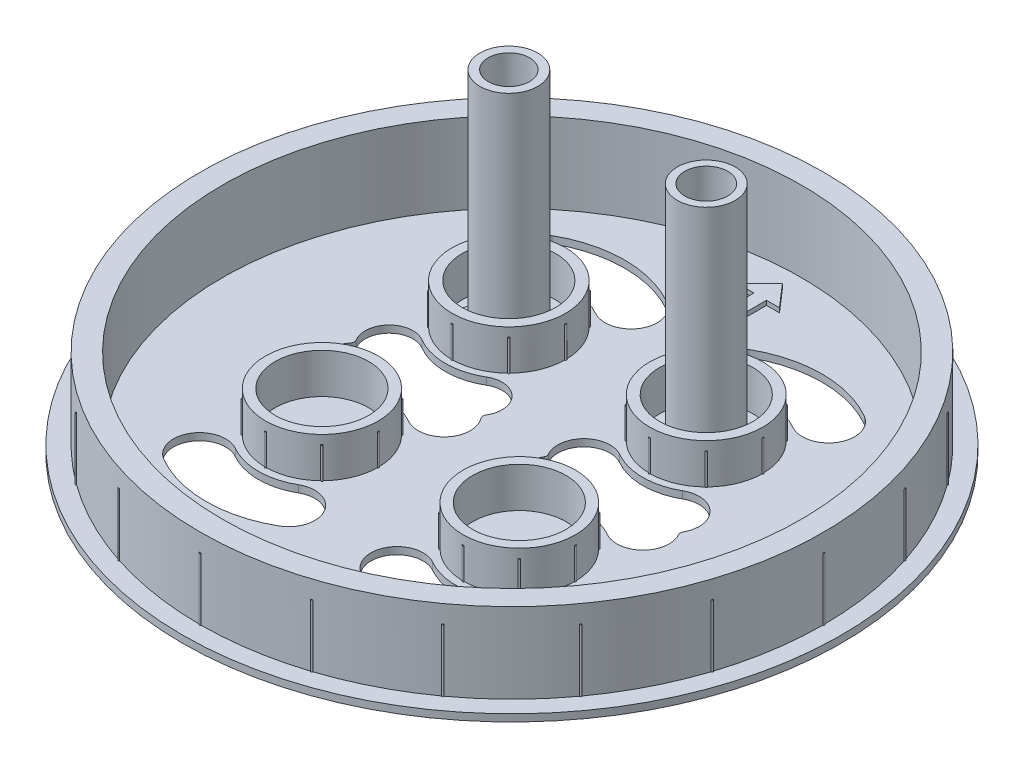
from build123d import *

# Parameters (mm, degrees)
SKETCH1_R           = 74
BOSS_EXTRUDE1_DEPTH = 1.6
SKETCH2_R           = 70
BOSS_EXTRUDE2_DEPTH = 18
SKETCH3_R           = 65
CUT_EXTRUDE1_DEPTH  = 18
SKETCH4_R           = 0.2
BOSS_EXTRUDE3_DEPTH = 14
SKETCH5_R           = 12.75
SKETCH5_R_2         = 12.7
SKETCH5_R_3         = 12.65
SKETCH5_R_4         = 12.6
BOSS_EXTRUDE4_DEPTH = 9
SKETCH6_R           = 10.5
CUT_EXTRUDE2_DEPTH  = 9
SKETCH7_R           = 0.2
BOSS_EXTRUDE5_DEPTH = 7
CUT_EXTRUDE4_DEPTH  = 107.18851162
SKETCH9_R           = 6.5
BOSS_EXTRUDE6_DEPTH = 50
SKETCH12_W          = 13.279060361
SKETCH12_H          = 13.344798284
BOSS_EXTRUDE7_DEPTH = 1
SKETCH14_R          = 4.825
CUT_EXTRUDE5_DEPTH  = 117.681446683
SKETCH15_R          = 4.825
CUT_EXTRUDE6_DEPTH  = 51.6
CUT_EXTRUDE6_DRAFT  = -0.2


with BuildPart() as part:
    # Sketch1 → Boss-Extrude1 (new body)
    with BuildSketch(Plane(origin=(0, 0, 0), x_dir=(1, 0, 0), z_dir=(0, 1, 0))):
        with Locations(Location((0, 0, 0), (0, 0, 270))):
            Circle(SKETCH1_R)
    extrude(amount=BOSS_EXTRUDE1_DEPTH)

    # Sketch2 → Boss-Extrude2 (add)
    with BuildSketch(Plane(origin=(0, 1.6, 0), x_dir=(1, 0, 0), z_dir=(0, 1, 0))):
        with Locations(Location((0, 0, 0), (0, 0, 270))):
            Circle(SKETCH2_R)
    extrude(amount=BOSS_EXTRUDE2_DEPTH)

    # Sketch3 → Cut-Extrude1 (cut)
    with BuildSketch(Plane(origin=(0, 19.6, 0), x_dir=(1, 0, 0), z_dir=(0, 1, 0))):
        with Locations(Location((0, 0, 0), (0, 0, 270))):
            Circle(SKETCH3_R)
    extrude(amount=-CUT_EXTRUDE1_DEPTH, mode=Mode.SUBTRACT)

    # Sketch4 → Boss-Extrude3 (add)
    with BuildSketch(Plane(origin=(0, 1.6, 0), x_dir=(1, 0, 0), z_dir=(0, 1, 0))):
        with Locations((0, 70)):
            Circle(SKETCH4_R)
        with Locations((21.631189606, 66.573956141)):
            Circle(SKETCH4_R)
        with Locations((41.14496766, 56.631189606)):
            Circle(SKETCH4_R)
        with Locations((56.631189606, 41.14496766)):
            Circle(SKETCH4_R)
        with Locations((66.573956141, 21.631189606)):
            Circle(SKETCH4_R)
        with Locations((70, 0)):
            Circle(SKETCH4_R)
        with Locations((66.573956141, -21.631189606)):
            Circle(SKETCH4_R)
        with Locations((56.631189606, -41.14496766)):
            Circle(SKETCH4_R)
        with Locations((41.14496766, -56.631189606)):
            Circle(SKETCH4_R)
        with Locations((21.631189606, -66.573956141)):
            Circle(SKETCH4_R)
        with Locations((0, -70)):
            Circle(SKETCH4_R)
        with Locations((-21.631189606, -66.573956141)):
            Circle(SKETCH4_R)
        with Locations((-41.14496766, -56.631189606)):
            Circle(SKETCH4_R)
        with Locations((-56.631189606, -41.14496766)):
            Circle(SKETCH4_R)
        with Locations((-66.573956141, -21.631189606)):
            Circle(SKETCH4_R)
        with Locations((-70, 0)):
            Circle(SKETCH4_R)
        with Locations((-66.573956141, 21.631189606)):
            Circle(SKETCH4_R)
        with Locations((-56.631189606, 41.14496766)):
            Circle(SKETCH4_R)
        with Locations((-41.14496766, 56.631189606)):
            Circle(SKETCH4_R)
        with Locations((-21.631189606, 66.573956141)):
            Circle(SKETCH4_R)
    extrude(amount=BOSS_EXTRUDE3_DEPTH)

    # Sketch5 → Boss-Extrude4 (add)
    with BuildSketch(Plane(origin=(0, 1.6, 0), x_dir=(1, 0, 0), z_dir=(0, 1, 0))):
        with Locations(Location((-23.270884348, 22.578298504, 0), (0, 0, 270))):
            Circle(SKETCH5_R)
        with Locations(Location((21.054609648, 22.578298504, 0), (0, 0, 270))):
            Circle(SKETCH5_R_2)
        with Locations(Location((-23.270884348, -19.392403623, 0), (0, 0, 270))):
            Circle(SKETCH5_R_3)
        with Locations(Location((21.054609648, -19.392403623, 0), (0, 0, 270))):
            Circle(SKETCH5_R_4)
    extrude(amount=BOSS_EXTRUDE4_DEPTH)

    # Sketch6 → Cut-Extrude2 (cut)
    with BuildSketch(Plane(origin=(0, 10.6, 0), x_dir=(1, 0, 0), z_dir=(0, 1, 0))):
        with Locations(Location((-23.270884348, 22.578298504, 0), (0, 0, 270))):
            Circle(SKETCH6_R)
        with Locations(Location((21.054609648, 22.578298504, 0), (0, 0, 270))):
            Circle(SKETCH6_R)
        with Locations(Location((21.054609648, -19.392403623, 0), (0, 0, 270))):
            Circle(SKETCH6_R)
        with Locations(Location((-23.270884348, -19.392403623, 0), (0, 0, 270))):
            Circle(SKETCH6_R)
    extrude(amount=-CUT_EXTRUDE2_DEPTH, mode=Mode.SUBTRACT)

    # Sketch7 → Boss-Extrude5 (add)
    with BuildSketch(Plane(origin=(0, 1.6, 0), x_dir=(1, 0, 0), z_dir=(0, 1, 0))):
        with Locations((-23.270884348, 35.328298504)):
            Circle(SKETCH7_R)
        with Locations((-14.255272888, 31.593909964)):
            Circle(SKETCH7_R)
        with Locations((-10.520884348, 22.578298504)):
            Circle(SKETCH7_R)
        with Locations((-14.255272888, 13.562687044)):
            Circle(SKETCH7_R)
        with Locations((-23.270884348, 9.828298504)):
            Circle(SKETCH7_R)
        with Locations((-32.286495808, 13.562687044)):
            Circle(SKETCH7_R)
        with Locations((-36.020884348, 22.578298504)):
            Circle(SKETCH7_R)
        with Locations((-32.286495808, 31.593909964)):
            Circle(SKETCH7_R)
        with Locations((21.054609648, 35.278298504)):
            Circle(SKETCH7_R)
        with Locations((-23.270884348, -6.742403623)):
            Circle(SKETCH7_R)
        with Locations((21.054609648, -6.792403623)):
            Circle(SKETCH7_R)
        with Locations((30.034865769, 31.558554625)):
            Circle(SKETCH7_R)
        with Locations((33.754609648, 22.578298504)):
            Circle(SKETCH7_R)
        with Locations((30.034865769, 13.598042383)):
            Circle(SKETCH7_R)
        with Locations((21.054609648, 9.878298504)):
            Circle(SKETCH7_R)
        with Locations((12.074353527, 13.598042383)):
            Circle(SKETCH7_R)
        with Locations((8.354609648, 22.578298504)):
            Circle(SKETCH7_R)
        with Locations((12.074353527, 31.558554625)):
            Circle(SKETCH7_R)
        with Locations((-14.325983566, -10.447502841)):
            Circle(SKETCH7_R)
        with Locations((-10.620884348, -19.392403623)):
            Circle(SKETCH7_R)
        with Locations((-14.325983566, -28.337304405)):
            Circle(SKETCH7_R)
        with Locations((-23.270884348, -32.042403623)):
            Circle(SKETCH7_R)
        with Locations((-32.21578513, -28.337304405)):
            Circle(SKETCH7_R)
        with Locations((-35.920884348, -19.392403623)):
            Circle(SKETCH7_R)
        with Locations((-32.21578513, -10.447502841)):
            Circle(SKETCH7_R)
        with Locations((29.964155091, -10.48285818)):
            Circle(SKETCH7_R)
        with Locations((33.654609648, -19.392403623)):
            Circle(SKETCH7_R)
        with Locations((29.964155091, -28.301949066)):
            Circle(SKETCH7_R)
        with Locations((21.054609648, -31.992403623)):
            Circle(SKETCH7_R)
        with Locations((12.145064205, -28.301949066)):
            Circle(SKETCH7_R)
        with Locations((8.454609648, -19.392403623)):
            Circle(SKETCH7_R)
        with Locations((12.145064205, -10.48285818)):
            Circle(SKETCH7_R)
    extrude(amount=BOSS_EXTRUDE5_DEPTH)

    # Sketch8 → Cut-Extrude4 (cut, through all)
    with BuildSketch(Plane(origin=(0, 1.6, 0), x_dir=(1, 0, 0), z_dir=(0, 1, 0))):
        with BuildLine():
            ThreePointArc((-10.351629689, 45.141384709), (-23.270884348, 48.578298504), (-36.190139006, 45.141384709))
            ThreePointArc((-36.190139006, 45.141384709), (-38.369274019, 37.123740379), (-30.351629689, 34.944605366))
            ThreePointArc((-30.351629689, 34.944605366), (-23.270884348, 36.828298504), (-16.190139006, 34.944605366))
            ThreePointArc((-16.190139006, 34.944605366), (-8.172494677, 37.123740379), (-10.351629689, 45.141384709))
        make_face()
        with BuildLine():
            ThreePointArc((33.973864306, 45.141384709), (21.054609648, 48.578298504), (8.13535499, 45.141384709))
            ThreePointArc((8.13535499, 45.141384709), (5.956219977, 37.123740379), (13.973864306, 34.944605366))
            ThreePointArc((13.973864306, 34.944605366), (21.054609648, 36.828298504), (28.13535499, 34.944605366))
            ThreePointArc((28.13535499, 34.944605366), (36.152999319, 37.123740379), (33.973864306, 45.141384709))
        make_face()
        with BuildLine():
            ThreePointArc((36.174177274, 1.250558767), (36.04559304, 1.741103936), (36.174177274, 2.231649105))
            ThreePointArc((36.174177274, 2.231649105), (35.193668846, 9.282992089), (28.13535499, 10.211991642))
            ThreePointArc((28.13535499, 10.211991642), (21.054609648, 8.328298504), (13.973864306, 10.211991642))
            ThreePointArc((13.973864306, 10.211991642), (6.91555045, 9.282992089), (5.935042022, 2.231649105))
            ThreePointArc((5.935042022, 2.231649105), (6.063626256, 1.741103936), (5.935042022, 1.250558767))
            ThreePointArc((5.935042022, 1.250558767), (6.91555045, -5.800784217), (13.973864306, -6.72978377))
            ThreePointArc((13.973864306, -6.72978377), (21.054609648, -4.846090632), (28.13535499, -6.72978377))
            ThreePointArc((28.13535499, -6.72978377), (35.193668846, -5.800784217), (36.174177274, 1.250558767))
        make_face()
        with BuildLine():
            ThreePointArc((-16.190139006, -7.026096761), (-23.270884348, -5.142403623), (-30.351629689, -7.026096761))
            ThreePointArc((-30.351629689, -7.026096761), (-37.713677441, -5.771821362), (-37.896724544, 1.694064227))
            ThreePointArc((-37.896724544, 1.694064227), (-37.68552175, 2.257260386), (-37.835601683, 2.839731455))
            ThreePointArc((-37.835601683, 2.839731455), (-37.118678495, 9.446483345), (-30.530273834, 10.316008168))
            ThreePointArc((-30.530273834, 10.316008168), (-23.270884348, 8.328298504), (-16.011494862, 10.316008168))
            ThreePointArc((-16.011494862, 10.316008168), (-9.423090201, 9.446483345), (-8.706167013, 2.839731455))
            ThreePointArc((-8.706167013, 2.839731455), (-8.856246945, 2.257260386), (-8.645044151, 1.694064227))
            ThreePointArc((-8.645044151, 1.694064227), (-8.828091255, -5.771821362), (-16.190139006, -7.026096761))
        make_face()
        with BuildLine():
            ThreePointArc((8.13535499, -41.955489828), (21.054609648, -45.392403623), (33.973864306, -41.955489828))
            ThreePointArc((33.973864306, -41.955489828), (36.152999319, -33.937845498), (28.13535499, -31.758710485))
            ThreePointArc((28.13535499, -31.758710485), (21.054609648, -33.642403623), (13.973864306, -31.758710485))
            ThreePointArc((13.973864306, -31.758710485), (5.956219977, -33.937845498), (8.13535499, -41.955489828))
        make_face()
        with BuildLine():
            ThreePointArc((-36.190139006, -41.955489828), (-23.270884348, -45.392403623), (-10.351629689, -41.955489828))
            ThreePointArc((-10.351629689, -41.955489828), (-8.172494677, -33.937845498), (-16.190139006, -31.758710485))
            ThreePointArc((-16.190139006, -31.758710485), (-23.270884348, -33.642403623), (-30.351629689, -31.758710485))
            ThreePointArc((-30.351629689, -31.758710485), (-38.369274019, -33.937845498), (-36.190139006, -41.955489828))
        make_face()
    extrude(amount=-CUT_EXTRUDE4_DEPTH, mode=Mode.SUBTRACT)

    # Sketch9 → Boss-Extrude6 (add)
    with BuildSketch(Plane(origin=(0, 1.6, 0), x_dir=(1, 0, 0), z_dir=(0, 1, 0))):
        with Locations(Location((-23.270884348, 22.578298504, 0), (0, 0, 270))):
            Circle(SKETCH9_R)
        with Locations(Location((21.054609648, 22.578298504, 0), (0, 0, 270))):
            Circle(SKETCH9_R)
    extrude(amount=BOSS_EXTRUDE6_DEPTH)

    # Sketch12 → Boss-Extrude7 (add)
    with BuildSketch(Plane(origin=(0, 1.6, 0), x_dir=(1, 0, 0), z_dir=(0, 1, 0))):
        Polygon((0, 60.738182758), (-5.067651269, 55.670531489), (-1.335466451, 55.670531489), (-1.335466451, 50.445517334), (1.493052292, 50.445517334), (1.493052292, 55.670531489), (4.400140999, 55.670531489), align=None)
        Polygon((-28.483134436, 29.46471422), (-31.891337007, 17.368936466), (-14.932768947, 17.368936466), (-18.08818923, 29.46471422), align=None)
        with Locations((21.025874705, 22.660839233)):
            Rectangle(SKETCH12_W, SKETCH12_H)
    extrude(amount=BOSS_EXTRUDE7_DEPTH)

    # Sketch14 → Cut-Extrude5 (cut, through all)
    with BuildSketch(Plane.XZ):
        with Locations(Location((21.054609648, -22.578298504, 0), (0, 0, 270))):
            Circle(SKETCH14_R)
    extrude(amount=-CUT_EXTRUDE5_DEPTH, mode=Mode.SUBTRACT)


with BuildPart() as cut_extrude6_tool:
    # Sketch15 → Cut-Extrude6 (with draft: the straight prism first)
    with BuildSketch(Plane.XZ):
        with Locations((-23.270884348, -22.578298504)):
            Circle(SKETCH15_R)
    extrude(amount=-CUT_EXTRUDE6_DEPTH)
    # Cut-Extrude6: the draft: its side faces are tilted about the plane it starts from
    cut_extrude6_sides = [cut_extrude6_tool.faces().sort_by_distance(p)[0] for p in [
        (-28.095884348, 25.8, -22.578298504),
    ]]
    draft(cut_extrude6_sides, Plane.XZ, CUT_EXTRUDE6_DRAFT)


with BuildPart() as part_1:
    add(part.part)

    # Cut-Extrude6: cut by cut_extrude6_tool
    add(cut_extrude6_tool.part, mode=Mode.SUBTRACT)


solid = part_1.part
